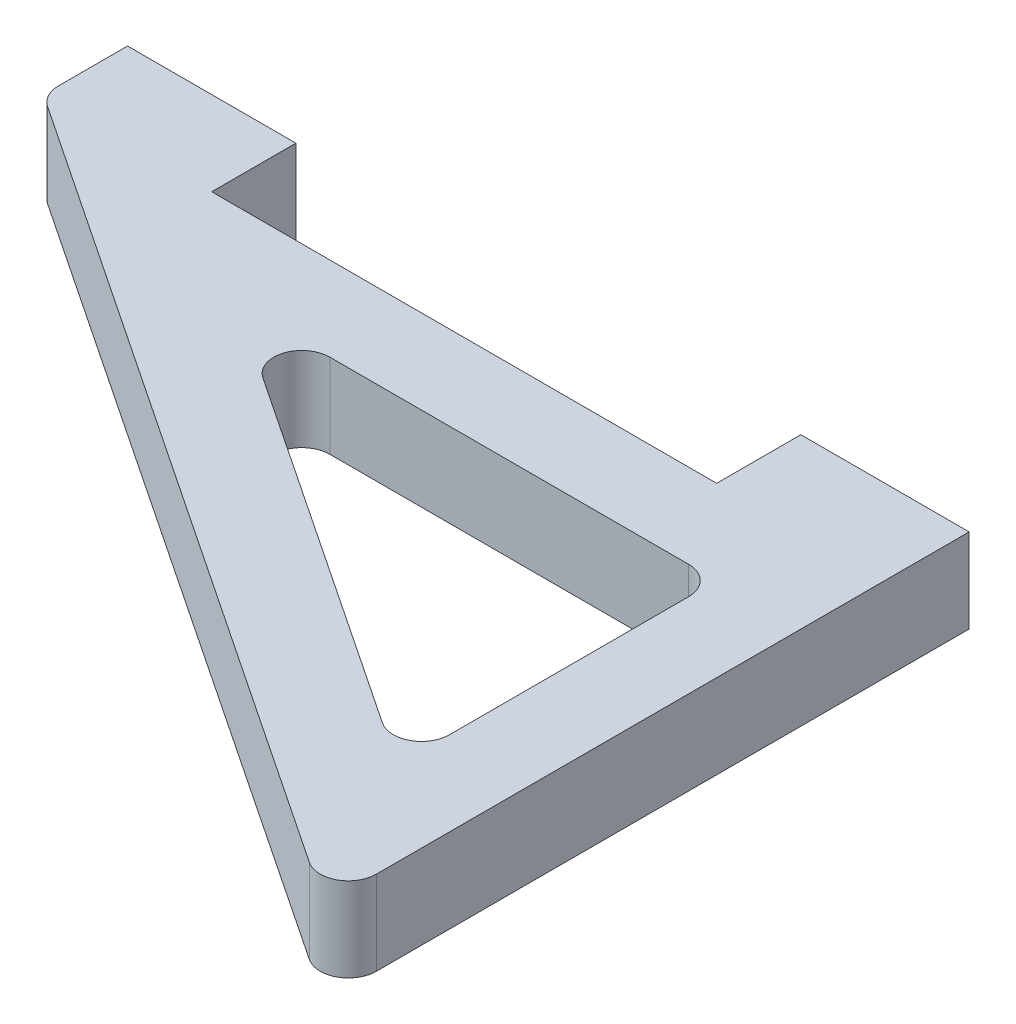
from build123d import *

# Parameters (mm, degrees)
SKETCH1_W           = 6
SKETCH1_H           = 3
BOSS_EXTRUDE1_DEPTH = 3
CUT_EXTRUDE1_REACH  = 28.387
FILLET1_R           = 1


with BuildPart() as part:
    # Sketch1 → Boss-Extrude1 (new body)
    with BuildSketch(Plane(origin=(0, 0, 0), x_dir=(1, 0, 0), z_dir=(0, 1, 0))):
        Polygon((-15, -1.5), (15, -21.5), (15, -1.5), align=None)
        with Locations((-12, 0)):
            Rectangle(SKETCH1_W, SKETCH1_H)
        with Locations((12, 0)):
            Rectangle(SKETCH1_W, SKETCH1_H)
    extrude(amount=BOSS_EXTRUDE1_DEPTH)

    # Sketch2 → Cut-Extrude1 (cut, up to next)
    with BuildSketch(Plane(origin=(0, 3, 0), x_dir=(1, 0, 0), z_dir=(0, 1, 0)), mode=Mode.PRIVATE) as cut_extrude1_sk1:
        Polygon((12, -15.894448725), (-5.091673087, -4.5), (12, -4.5), align=None)
    cut_extrude1_tool1 = extrude(cut_extrude1_sk1.sketch, amount=-CUT_EXTRUDE1_REACH, mode=Mode.PRIVATE) & part.part
    add(cut_extrude1_tool1.solids().sort_by_distance((6.302776, 3, 8.29815))[0], mode=Mode.SUBTRACT)

    # Fillet1
    fillet1_edges = [part.edges().sort_by_distance(p)[0] for p in [
        (-15, 1.5, 1.5),
        (15, 1.5, 21.5),
        (12, 1.5, 15.894448725),
        (-5.091673087, 1.5, 4.5),
        (12, 1.5, 4.5),
    ]]
    fillet(fillet1_edges, radius=FILLET1_R)


solid = part.part
